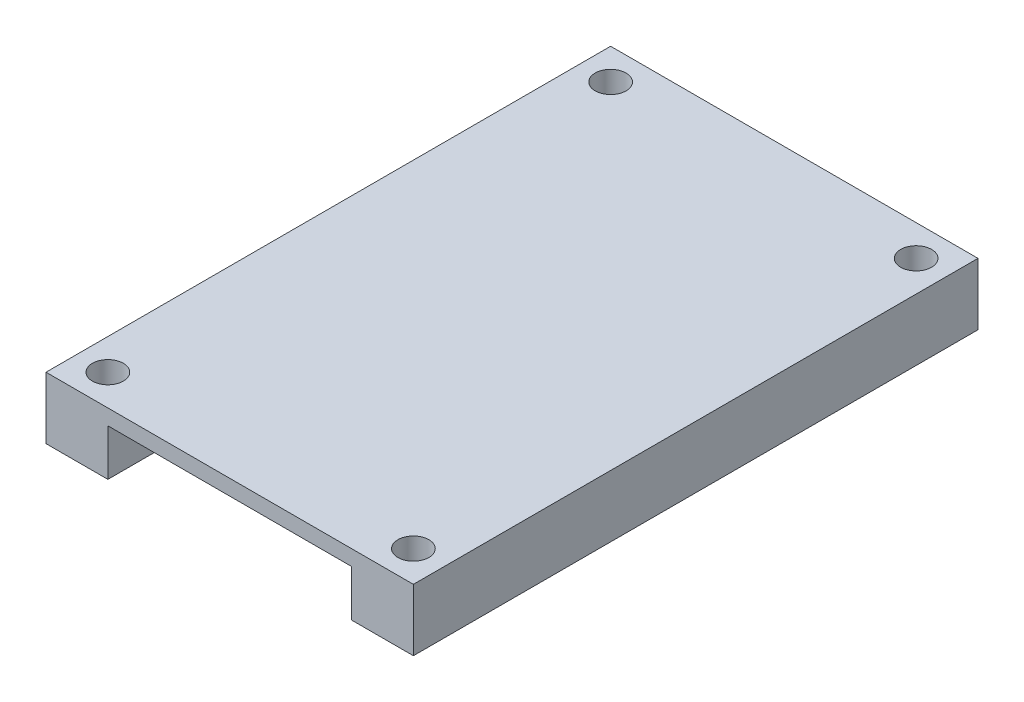
from build123d import *

# Parameters (mm, degrees)
SKETCH1_W           = 47.5
SKETCH1_H           = 73
BOSS_EXTRUDE2_DEPTH = 8
CUT_EXTRUDE7_DEPTH  = 6
SKETCH1_9_R         = 2
CUT_EXTRUDE10_DEPTH = 125.324529963


with BuildPart() as part:
    # Sketch1 → Boss-Extrude2 (new body)
    with BuildSketch(Plane(origin=(0, 0, 0), x_dir=(1, 0, 0), z_dir=(0, 1, 0))):
        with Locations((-94.251130157, 1.818690378)):
            Rectangle(SKETCH1_W, SKETCH1_H)
    extrude(amount=BOSS_EXTRUDE2_DEPTH)

    # Sketch1<8> → Cut-Extrude7 (cut)
    with BuildSketch(Plane(origin=(0, 0, 0), x_dir=(1, 0, 0), z_dir=(0, 1, 0))):
        Polygon((-110.001130157, 38.318690378), (-110.001130157, 30.318690378), (-114.001130157, 30.318690378), (-114.001130157, -26.681309622), (-110.001130157, -26.681309622), (-110.001130157, -34.681309622), (-78.501130157, -34.681309622), (-78.501130157, -26.681309622), (-74.501130157, -26.681309622), (-74.501130157, 30.318690378), (-78.501130157, 30.318690378), (-78.501130157, 38.318690378), align=None)
    extrude(amount=CUT_EXTRUDE7_DEPTH, mode=Mode.SUBTRACT)

    # Sketch1<9> → Cut-Extrude10 (cut, through all)
    with BuildSketch(Plane(origin=(0, 0, 0), x_dir=(1, 0, 0), z_dir=(0, 1, 0))):
        with Locations((-114.001130157, 34.318690378)):
            Circle(SKETCH1_9_R)
        with Locations((-74.501130157, 34.318690378)):
            Circle(SKETCH1_9_R)
        with Locations((-114.001130157, -30.681309622)):
            Circle(SKETCH1_9_R)
        with Locations((-74.501130157, -30.681309622)):
            Circle(SKETCH1_9_R)
    extrude(amount=CUT_EXTRUDE10_DEPTH, mode=Mode.SUBTRACT)


solid = part.part
